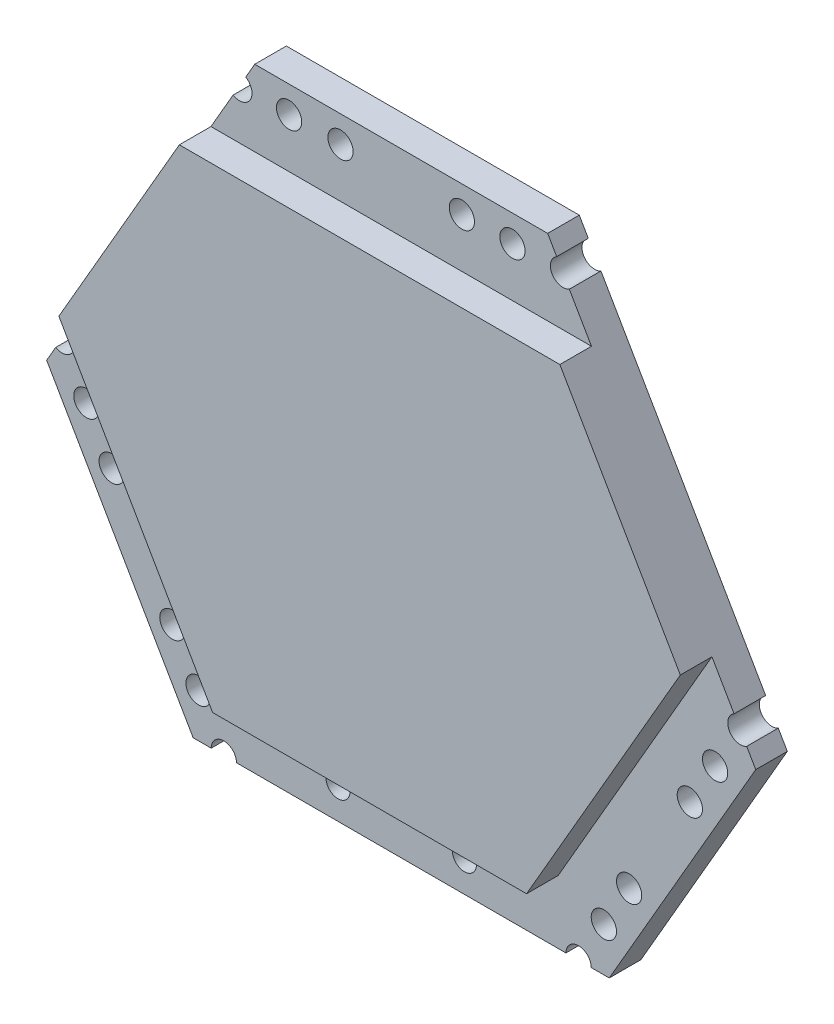
from build123d import *

# Parameters (mm, degrees)
EXTRUDE_4_DEPTH      = 10
SKETCH_4_W           = 60.2
SKETCH_4_H           = 12
CUT_EXTRUDE_2_DEPTH  = 5
CUT_EXTRUDE_9_DEPTH  = 125.764203881
CUT_EXTRUDE_12_DEPTH = 127.561979888
CUT_EXTRUDE_13_DEPTH = 124.620047186
CUT_EXTRUDE_15_DEPTH = 2
SKETCH_20_R          = 1.9
CUT_EXTRUDE_18_DEPTH = 10
CUT_EXTRUDE_19_DEPTH = 5


with BuildPart() as part:
    # 草圖1 → 填料-伸長4 (new body)
    with BuildSketch(Plane.XY):
        Polygon((49.802669845, 25.924393386), (-10.397330155, 25.924393386), (-29.457330155, -7.088495007), (0.642669845, -59.223224314), (38.762669845, -59.223224314), (68.862669845, -7.088495007), align=None)
        with BuildLine():
            Line((-0.037670798, 33.71862202), (-3.897330155, 33.71862202))
            ThreePointArc((-3.897330155, 33.71862202), (-4.897330155, 31.986571212), (-6.897330155, 31.986571212))
            Line((-6.897330155, 31.986571212), (-10.397330155, 25.924393386))
            Line((-10.397330155, 25.924393386), (49.802669845, 25.924393386))
            Line((49.802669845, 25.924393386), (46.302669845, 31.986571212))
            ThreePointArc((46.302669845, 31.986571212), (44.302669845, 31.986571212), (43.302669845, 33.71862202))
            Line((43.302669845, 33.71862202), (39.302669845, 33.71862202))
            ThreePointArc((39.302669845, 33.71862202), (37.302669845, 31.71862202), (35.302669845, 33.71862202))
            Line((35.302669845, 33.71862202), (31.302669845, 33.71862202))
            ThreePointArc((31.302669845, 33.71862202), (29.302669845, 31.71862202), (27.302669845, 33.71862202))
            Line((27.302669845, 33.71862202), (12.102669845, 33.71862202))
            ThreePointArc((12.102669845, 33.71862202), (10.102669845, 31.71862202), (8.102669845, 33.71862202))
            Line((8.102669845, 33.71862202), (3.962329202, 33.71862202))
            ThreePointArc((3.962329202, 33.71862202), (1.962329202, 31.71862202), (-0.037670798, 33.71862202))
        make_face()
        with BuildLine():
            ThreePointArc((-6.897330155, 31.986571212), (-6.897330155, 35.450672827), (-3.897330155, 33.71862202))
            Line((-3.897330155, 33.71862202), (-0.037670798, 33.71862202))
            ThreePointArc((-0.037670798, 33.71862202), (1.962329202, 35.71862202), (3.962329202, 33.71862202))
            Line((3.962329202, 33.71862202), (8.102669845, 33.71862202))
            ThreePointArc((8.102669845, 33.71862202), (10.102669845, 35.71862202), (12.102669845, 33.71862202))
            Line((12.102669845, 33.71862202), (27.302669845, 33.71862202))
            ThreePointArc((27.302669845, 33.71862202), (29.302669845, 35.71862202), (31.302669845, 33.71862202))
            Line((31.302669845, 33.71862202), (35.302669845, 33.71862202))
            ThreePointArc((35.302669845, 33.71862202), (37.302669845, 35.71862202), (39.302669845, 33.71862202))
            Line((39.302669845, 33.71862202), (43.302669845, 33.71862202))
            ThreePointArc((43.302669845, 33.71862202), (45.302669845, 35.71862202), (47.302669845, 33.71862202))
            ThreePointArc((47.302669845, 33.71862202), (47.034720652, 32.71862202), (46.302669845, 31.986571212))
            Line((46.302669845, 31.986571212), (49.802669845, 25.924393386))
            Line((49.802669845, 25.924393386), (49.802669845, 37.924393386))
            Line((49.802669845, 37.924393386), (-10.397330155, 37.924393386))
            Line((-10.397330155, 37.924393386), (-10.397330155, 25.924393386))
            Line((-10.397330155, 25.924393386), (-6.897330155, 31.986571212))
        make_face()
        with BuildLine():
            Line((-32.957330155, -13.150672833), (-29.457330155, -7.088495007))
            Line((-29.457330155, -7.088495007), (-39.849635001, -13.088495007))
            Line((-39.849635001, -13.088495007), (-9.749635001, -65.223224314))
            Line((-9.749635001, -65.223224314), (0.642669845, -59.223224314))
            Line((0.642669845, -59.223224314), (-6.357330155, -59.223224314))
            ThreePointArc((-6.357330155, -59.223224314), (-9.357330155, -60.955275122), (-9.357330155, -57.491173507))
            Line((-9.357330155, -57.491173507), (-11.357330155, -54.027071892))
            ThreePointArc((-11.357330155, -54.027071892), (-14.089380963, -53.295021084), (-13.357330155, -50.562970277))
            Line((-13.357330155, -50.562970277), (-15.394263476, -47.034898273))
            ThreePointArc((-15.394263476, -47.034898273), (-18.229721605, -46.366817854), (-17.390567155, -43.577198874))
            Line((-17.390567155, -43.577198874), (-24.994263476, -30.40721052))
            ThreePointArc((-24.994263476, -30.40721052), (-27.829721605, -29.739130101), (-26.990567155, -26.949511121))
            Line((-26.990567155, -26.949511121), (-28.994263476, -23.47900729))
            ThreePointArc((-28.994263476, -23.47900729), (-31.829721605, -22.810926871), (-30.990567155, -20.021307891))
            Line((-30.990567155, -20.021307891), (-32.957330155, -16.614774448))
            ThreePointArc((-32.957330155, -16.614774448), (-35.957330155, -14.882723641), (-32.957330155, -13.150672833))
        make_face()
        with BuildLine():
            Line((0.642669845, -59.223224314), (-29.457330155, -7.088495007))
            Line((-29.457330155, -7.088495007), (-32.957330155, -13.150672833))
            ThreePointArc((-32.957330155, -13.150672833), (-32.225279348, -13.882723641), (-31.957330155, -14.882723641))
            ThreePointArc((-31.957330155, -14.882723641), (-32.225279348, -15.882723641), (-32.957330155, -16.614774448))
            Line((-32.957330155, -16.614774448), (-30.990567155, -20.021307891))
            ThreePointArc((-30.990567155, -20.021307891), (-29.045480871, -20.110075214), (-28.097670798, -21.810926871))
            ThreePointArc((-28.097670798, -21.810926871), (-28.336021763, -22.75781265), (-28.994263476, -23.47900729))
            Line((-28.994263476, -23.47900729), (-26.990567155, -26.949511121))
            ThreePointArc((-26.990567155, -26.949511121), (-25.045480871, -27.038278445), (-24.097670798, -28.739130101))
            ThreePointArc((-24.097670798, -28.739130101), (-24.336021763, -29.68601588), (-24.994263476, -30.40721052))
            Line((-24.994263476, -30.40721052), (-17.390567155, -43.577198874))
            ThreePointArc((-17.390567155, -43.577198874), (-15.445480871, -43.665966197), (-14.497670798, -45.366817854))
            ThreePointArc((-14.497670798, -45.366817854), (-14.736021763, -46.313703633), (-15.394263476, -47.034898273))
            Line((-15.394263476, -47.034898273), (-13.357330155, -50.562970277))
            ThreePointArc((-13.357330155, -50.562970277), (-11.357330155, -50.562970277), (-10.357330155, -52.295021084))
            ThreePointArc((-10.357330155, -52.295021084), (-10.625279348, -53.295021084), (-11.357330155, -54.027071892))
            Line((-11.357330155, -54.027071892), (-9.357330155, -57.491173507))
            ThreePointArc((-9.357330155, -57.491173507), (-7.357330155, -57.491173507), (-6.357330155, -59.223224314))
            Line((-6.357330155, -59.223224314), (0.642669845, -59.223224314))
        make_face()
        with BuildLine():
            Line((79.25497469, -13.088495007), (68.862669845, -7.088495007))
            Line((68.862669845, -7.088495007), (72.362669845, -13.150672833))
            ThreePointArc((72.362669845, -13.150672833), (74.362669845, -13.150672833), (75.362669845, -14.882723641))
            ThreePointArc((75.362669845, -14.882723641), (74.362669845, -16.614774448), (72.362669845, -16.614774448))
            Line((72.362669845, -16.614774448), (70.362669845, -20.078876063))
            ThreePointArc((70.362669845, -20.078876063), (71.094720652, -20.810926871), (71.362669845, -21.810926871))
            ThreePointArc((71.362669845, -21.810926871), (70.362669845, -23.542977679), (68.362669845, -23.542977679))
            Line((68.362669845, -23.542977679), (66.362669845, -27.007079294))
            ThreePointArc((66.362669845, -27.007079294), (67.094720652, -27.739130101), (67.362669845, -28.739130101))
            ThreePointArc((67.362669845, -28.739130101), (66.362669845, -30.471180909), (64.362669845, -30.471180909))
            Line((64.362669845, -30.471180909), (56.762669845, -43.634767046))
            ThreePointArc((56.762669845, -43.634767046), (57.494720652, -44.366817854), (57.762669845, -45.366817854))
            ThreePointArc((57.762669845, -45.366817854), (56.762669845, -47.098868661), (54.762669845, -47.098868661))
            Line((54.762669845, -47.098868661), (52.762669845, -50.562970277))
            ThreePointArc((52.762669845, -50.562970277), (53.494720652, -51.295021084), (53.762669845, -52.295021084))
            ThreePointArc((53.762669845, -52.295021084), (52.762669845, -54.027071892), (50.762669845, -54.027071892))
            Line((50.762669845, -54.027071892), (48.762669845, -57.491173507))
            ThreePointArc((48.762669845, -57.491173507), (49.494720652, -58.223224314), (49.762669845, -59.223224314))
            ThreePointArc((49.762669845, -59.223224314), (47.762669845, -61.223224314), (45.762669845, -59.223224314))
            Line((45.762669845, -59.223224314), (38.762669845, -59.223224314))
            Line((38.762669845, -59.223224314), (49.15497469, -65.223224314))
            Line((49.15497469, -65.223224314), (79.25497469, -13.088495007))
        make_face()
        with BuildLine():
            Line((72.362669845, -13.150672833), (68.862669845, -7.088495007))
            Line((68.862669845, -7.088495007), (38.762669845, -59.223224314))
            Line((38.762669845, -59.223224314), (45.762669845, -59.223224314))
            ThreePointArc((45.762669845, -59.223224314), (46.762669845, -57.491173507), (48.762669845, -57.491173507))
            Line((48.762669845, -57.491173507), (50.762669845, -54.027071892))
            ThreePointArc((50.762669845, -54.027071892), (50.030619037, -51.295021084), (52.762669845, -50.562970277))
            Line((52.762669845, -50.562970277), (54.762669845, -47.098868661))
            ThreePointArc((54.762669845, -47.098868661), (54.030619037, -44.366817854), (56.762669845, -43.634767046))
            Line((56.762669845, -43.634767046), (64.362669845, -30.471180909))
            ThreePointArc((64.362669845, -30.471180909), (63.630619037, -27.739130101), (66.362669845, -27.007079294))
            Line((66.362669845, -27.007079294), (68.362669845, -23.542977679))
            ThreePointArc((68.362669845, -23.542977679), (67.630619037, -20.810926871), (70.362669845, -20.078876063))
            Line((70.362669845, -20.078876063), (72.362669845, -16.614774448))
            ThreePointArc((72.362669845, -16.614774448), (71.362669845, -14.882723641), (72.362669845, -13.150672833))
        make_face()
    extrude(amount=EXTRUDE_4_DEPTH)

    # 草圖4 → 除料-伸長2 (cut)
    with BuildSketch(Plane.XY.offset(10)):
        Polygon((38.762669845, -59.223224314), (49.15497469, -65.223224314), (79.264488572, -13.07201648), (68.872183727, -7.07201648), align=None)
        with Locations((19.702669845, 31.924393386)):
            Rectangle(SKETCH_4_W, SKETCH_4_H)
        Polygon((-29.457330155, -7.088495007), (-39.849635001, -13.088495007), (-9.472158735, -65.703827304), (0.92014611, -59.703827304), align=None)
    extrude(amount=-CUT_EXTRUDE_2_DEPTH, mode=Mode.SUBTRACT)

    # 草圖7 → 除料-伸長9 (cut, through all)
    with BuildSketch(Plane(origin=(-19.023589241, 10.983274369, 0), x_dir=(0, 0, 1), z_dir=(-0.8660254037844397, 0.499999999999998, 0))):
        Polygon((5, -20.867481828), (0, -20.867481828), (0, -53.816238545), (10, -53.816238545), (10, -20.867481828), align=None)
        Polygon((0, 46.26799966), (0, 17.252518172), (5, 17.252518172), (10, 17.252518172), (10, 46.26799966), align=None)
    extrude(amount=CUT_EXTRUDE_9_DEPTH, mode=Mode.SUBTRACT)

    # 草圖12 → 除料-伸長12 (cut, through all)
    with BuildSketch(Plane(origin=(48.577594008, 28.046286977, 0), x_dir=(0, 0, -1), z_dir=(0.8660254037844363, 0.5000000000000042, 0))):
        Polygon((0, -70.38008838), (0, -40.570151673), (-5, -40.570151673), (-10, -40.570151673), (-10, -70.38008838), align=None)
        Polygon((-5, -2.450151673), (0, -2.450151673), (0, 27.877960609), (-10, 27.877960609), (-10, -2.450151673), align=None)
    extrude(amount=CUT_EXTRUDE_12_DEPTH, mode=Mode.SUBTRACT)

    # 草圖13 → 除料-伸長13 (cut, through all)
    with BuildSketch(Plane.XZ.offset(59.223224314)):
        Polygon((66.260162627, 10), (38.762669845, 10), (38.762669845, 5), (38.762669845, 0), (66.260162627, 0), align=None)
        Polygon((0.642669845, 5), (0.642669845, 10), (-25.338575987, 10), (-25.338575987, 0), (0.642669845, 0), align=None)
    extrude(amount=CUT_EXTRUDE_13_DEPTH, mode=Mode.SUBTRACT)

    # 草圖17 → 除料-伸長15 (cut)
    # profile 1 of 6: a face of its own
    with BuildSketch(Plane(origin=(0, 0, 0), x_dir=(-1, 0, 0), z_dir=(0, 0, -1))):
        with BuildLine():
            Line((-28.264869636, -8.814389023), (-26.341517093, -8.814389023))
            add(Edge.make_bspline(
                [(-26.341517093, -8.814389023), (-26.267762258, -8.815115902), (-26.125122028, -8.81652167), (-25.917994809, -8.821198537), (-25.724588531, -8.831498349), (-25.545173867, -8.848220675), (-25.379122319, -8.865738903), (-25.227129952, -8.890048986), (-25.088726858, -8.917588419), (-24.962442322, -8.949442158), (-24.846181362, -8.988723142), (-24.736434733, -9.034877236), (-24.633052769, -9.09146439), (-24.535793645, -9.157147599), (-24.44309089, -9.23066092), (-24.356661164, -9.313299245), (-24.276156697, -9.404856412), (-24.200765488, -9.505399171), (-24.131548469, -9.618323397), (-24.073246605, -9.747418162), (-24.024668758, -9.892341629), (-23.982810629, -10.052463218), (-23.953582049, -10.228812497), (-23.931027342, -10.420501005), (-23.915691302, -10.628199446), (-23.914797229, -10.772367713), (-23.914334154, -10.847038106)],
                knots=[0, 0, 0, 0, 1.41969272, 2.745654521, 3.987543411, 5.14658096, 6.21373459, 7.200711201, 8.108042895, 8.929411192, 9.70554979, 10.467999137, 11.218070552, 11.969943563, 12.724535131, 13.49271798, 14.268243868, 15.068689038, 15.909069341, 16.81215954, 17.78844528, 18.848344307, 19.994182421, 21.225693104, 22.563077773, 24, 24, 24, 24], degree=3))
            add(Edge.make_bspline(
                [(-23.914334154, -10.847038106), (-23.914545592, -10.897268376), (-23.914952171, -10.993857585), (-23.926359188, -11.132606), (-23.942081658, -11.259389383), (-23.962464159, -11.375166198), (-23.99183029, -11.478452761), (-24.026413023, -11.570667737), (-24.0673573, -11.65118762), (-24.116534517, -11.721401469), (-24.175850425, -11.782838537), (-24.246487256, -11.839097947), (-24.328513003, -11.89209201), (-24.423970742, -11.939643172), (-24.529946257, -11.987246124), (-24.650266399, -12.026701299), (-24.781418342, -12.06661713), (-24.873852581, -12.087658071), (-24.921994946, -12.098616788)],
                knots=[0, 0, 0, 0, 1.327920484, 2.553495959, 3.678584238, 4.706394844, 5.65862556, 6.514014339, 7.30753027, 8.04101456, 8.772331145, 9.55771541, 10.424646689, 11.349518022, 12.375513716, 13.493956262, 14.694781581, 16, 16, 16, 16], degree=3))
            add(Edge.make_bspline(
                [(-24.921994946, -12.098616788), (-24.87070196, -12.111229348), (-24.771641552, -12.135587558), (-24.630933388, -12.182628868), (-24.503128838, -12.235715251), (-24.387482117, -12.293945116), (-24.285245803, -12.359726309), (-24.195785759, -12.431551488), (-24.118375022, -12.50916541), (-24.054998232, -12.595151954), (-24.000825085, -12.689169527), (-23.95400598, -12.793541234), (-23.916196822, -12.90998304), (-23.883985732, -13.03775057), (-23.859030899, -13.17669102), (-23.842129631, -13.327642225), (-23.83143877, -13.48955044), (-23.829848941, -13.6016488), (-23.829029537, -13.659424708)],
                knots=[0, 0, 0, 0, 1.193541528, 2.305046348, 3.349469872, 4.319601517, 5.227715379, 6.091898615, 6.908561027, 7.697906746, 8.498857849, 9.357421084, 10.27838222, 11.262396817, 12.333987418, 13.466302598, 14.694123014, 16, 16, 16, 16], degree=3))
            Line((-23.829029537, -13.659424708), (-23.829029537, -14.340528761))
            add(Edge.make_bspline(
                [(-23.829029537, -14.340528761), (-23.829505112, -14.400518082), (-23.830425013, -14.51655473), (-23.838478833, -14.684611184), (-23.851525572, -14.840705903), (-23.86996245, -14.984848735), (-23.893688343, -15.117061175), (-23.922765716, -15.237339911), (-23.957102227, -15.345782049), (-24.009390324, -15.471867389), (-24.089879669, -15.610982556), (-24.215684315, -15.750115201), (-24.366155705, -15.861445774), (-24.514101564, -15.92923552), (-24.65254922, -15.968458762), (-24.782211478, -15.994784395), (-24.935730119, -16.016942256), (-25.114202653, -16.033208005), (-25.315917824, -16.047983273), (-25.542569572, -16.058779324), (-25.793240946, -16.063115231), (-25.968753201, -16.064539021), (-26.060278433, -16.065281492)],
                knots=[0, 0, 0, 0, 1.057231904, 2.044991421, 2.964498811, 3.817267374, 4.605195048, 5.330688826, 5.996832831, 6.607610909, 7.734358025, 8.809960447, 9.890596186, 11.011751471, 11.656044114, 12.423911222, 13.341950389, 14.388368498, 15.581715371, 16.906549738, 18.386843414, 20, 20, 20, 20], degree=3))
            Line((-26.060278433, -16.065281492), (-28.264869636, -16.065281492))
            Line((-28.264869636, -16.065281492), (-28.264869636, -8.814389023))
        make_face()
        with BuildLine():
            Line((-26.388168055, -10.008653665), (-26.388168055, -11.629441393))
            add(Edge.make_bspline(
                [(-26.388168055, -11.629441393), (-26.348627402, -11.628467699), (-26.279324388, -11.626761104), (-26.210006709, -11.625838817), (-26.180238051, -11.625442739)],
                knots=[0, 0, 0, 0, 1.141094767, 2, 2, 2, 2], degree=3))
            add(Edge.make_bspline(
                [(-26.180238051, -11.625442739), (-26.13339575, -11.624601426), (-26.048527942, -11.623077154), (-25.934771281, -11.596358512), (-25.846030816, -11.555163468), (-25.792635238, -11.499907409), (-25.766930352, -11.441478395), (-25.750106372, -11.382794381), (-25.737820926, -11.3080112), (-25.725640796, -11.217839383), (-25.716796995, -11.11106724), (-25.710343018, -10.988836379), (-25.706373156, -10.850617975), (-25.705953409, -10.753294588), (-25.705731117, -10.70175368)],
                knots=[0, 0, 0, 0, 1.37184632, 2.485479705, 3.407178563, 4.210095408, 4.671083265, 5.269542147, 5.998719677, 6.893441603, 7.940942625, 9.142754617, 10.486848569, 12, 12, 12, 12], degree=3))
            add(Edge.make_bspline(
                [(-25.705731117, -10.70175368), (-25.706198799, -10.64883793), (-25.707061326, -10.551247575), (-25.720353628, -10.418015675), (-25.73960551, -10.309521989), (-25.770856552, -10.22507981), (-25.809226319, -10.16018185), (-25.852546404, -10.10960011), (-25.900954065, -10.070757882), (-25.959328104, -10.045363778), (-26.032540593, -10.030012715), (-26.127520941, -10.018871401), (-26.248997502, -10.011321367), (-26.338839535, -10.009599223), (-26.388168055, -10.008653665)],
                knots=[0, 0, 0, 0, 1.612962093, 2.974720053, 4.080187332, 4.963539136, 5.704836737, 6.3676796, 6.985654596, 7.580003915, 8.289925548, 9.259673838, 10.495400982, 12, 12, 12, 12], degree=3))
        make_face(mode=Mode.SUBTRACT)
        with BuildLine():
            Line((-26.388168055, -12.738401418), (-26.388168055, -14.87101685))
            add(Edge.make_bspline(
                [(-26.388168055, -14.87101685), (-26.35305961, -14.869447307), (-26.28632605, -14.866463945), (-26.191048904, -14.858980228), (-26.106164604, -14.846780723), (-26.030668981, -14.832791901), (-25.965259964, -14.813971145), (-25.909244516, -14.793165974), (-25.862715198, -14.769673145), (-25.825758674, -14.740281269), (-25.796642501, -14.703032502), (-25.771038564, -14.65751132), (-25.751977124, -14.599851142), (-25.734810026, -14.532653675), (-25.721639155, -14.454624646), (-25.713051255, -14.365993418), (-25.705627469, -14.266895385), (-25.70569558, -14.197038003), (-25.705731117, -14.160589334)],
                knots=[0, 0, 0, 0, 1.419095288, 2.697393149, 3.856866357, 4.880718774, 5.794967692, 6.601281627, 7.291456808, 7.891047755, 8.490638702, 9.189387817, 9.989490768, 10.933700266, 11.989587216, 13.180284702, 14.528790147, 16, 16, 16, 16], degree=3))
            Line((-25.705731117, -14.160589334), (-25.705731117, -13.448828934))
            add(Edge.make_bspline(
                [(-25.705731117, -13.448828934), (-25.70589286, -13.410174498), (-25.706199794, -13.336821112), (-25.710970428, -13.232667429), (-25.721522564, -13.14044912), (-25.729773612, -13.059711845), (-25.747012676, -12.991914807), (-25.764397444, -12.935368222), (-25.787013738, -12.890838403), (-25.813350404, -12.855669945), (-25.849250442, -12.830476588), (-25.892970299, -12.807968397), (-25.948919789, -12.789906803), (-26.015373432, -12.774304516), (-26.092865593, -12.761232827), (-26.181382347, -12.75072845), (-26.280987773, -12.742870511), (-26.351278671, -12.739939593), (-26.388168055, -12.738401418)],
                knots=[0, 0, 0, 0, 1.538310229, 2.919206019, 4.145426389, 5.233175983, 6.142307499, 6.925059207, 7.5813867, 8.122596664, 8.653013429, 9.309340922, 10.075339784, 10.9844713, 12.025073956, 13.200531974, 14.530810454, 16, 16, 16, 16], degree=3))
        make_face(mode=Mode.SUBTRACT)
    # profile 2 of 6: a face of its own
    with BuildSketch(Plane(origin=(0, 0, 0), x_dir=(-1, 0, 0), z_dir=(0, 0, -1))):
        with BuildLine():
            Line((-19.051970968, -10.093958282), (-19.051970968, -16.065281492))
            Line((-19.051970968, -16.065281492), (-20.872691394, -16.065281492))
            Line((-20.872691394, -16.065281492), (-20.843367932, -15.554786673))
            add(Edge.make_bspline(
                [(-20.843367932, -15.554786673), (-20.874561057, -15.602372526), (-20.935288618, -15.695013863), (-21.045492849, -15.815791893), (-21.164252292, -15.919778896), (-21.294628914, -16.004124678), (-21.4348255, -16.070446461), (-21.585599233, -16.116909205), (-21.746421104, -16.145530556), (-21.857127576, -16.148876875), (-21.913674302, -16.150586109)],
                knots=[0, 0, 0, 0, 1.061666706, 2.066879479, 3.043894156, 4.004116477, 4.958543322, 5.932696836, 6.944061519, 8, 8, 8, 8], degree=3))
            add(Edge.make_bspline(
                [(-21.913674302, -16.150586109), (-21.977320315, -16.148883933), (-22.099437057, -16.14561799), (-22.274236592, -16.118411095), (-22.433154809, -16.075805994), (-22.573790928, -16.012107986), (-22.698074444, -15.935393045), (-22.801887793, -15.842448198), (-22.89428073, -15.743015815), (-22.963237712, -15.628102373), (-23.019241662, -15.507903276), (-23.062359129, -15.384278164), (-23.096874725, -15.258950394), (-23.115047393, -15.15008024), (-23.123138033, -15.053220645), (-23.13003851, -14.964841798), (-23.135179206, -14.860392925), (-23.138686045, -14.740397451), (-23.143129752, -14.604463561), (-23.145526106, -14.452499122), (-23.146901146, -14.284550315), (-23.146698517, -14.167254082), (-23.146592598, -14.105941064)],
                knots=[0, 0, 0, 0, 1.372356562, 2.633121929, 3.807600132, 4.910298633, 5.952776581, 6.944670893, 7.908661259, 8.868831557, 9.820833315, 10.766735229, 11.689826756, 12.622720248, 13.142547126, 13.786556214, 14.535201573, 15.398368654, 16.376504451, 17.469410664, 18.677211821, 20, 20, 20, 20], degree=3))
            Line((-23.146592598, -14.105941064), (-23.146592598, -10.093958282))
            Line((-23.146592598, -10.093958282), (-21.355195635, -10.093958282))
            Line((-21.355195635, -10.093958282), (-21.355195635, -14.165920873))
            add(Edge.make_bspline(
                [(-21.355195635, -14.165920873), (-21.355483268, -14.22146045), (-21.356026359, -14.326327178), (-21.352441081, -14.474704868), (-21.350430116, -14.604910953), (-21.346437004, -14.717334448), (-21.34134959, -14.8120173), (-21.334912995, -14.88937449), (-21.327560195, -14.949151643), (-21.316329142, -15.003533174), (-21.292973204, -15.055582882), (-21.242936007, -15.097903731), (-21.177569732, -15.123847815), (-21.128436747, -15.125850818), (-21.101947553, -15.126930702)],
                knots=[0, 0, 0, 0, 1.812042913, 3.421398194, 4.842335651, 6.06080483, 7.091677302, 7.935583642, 8.593692084, 9.054393081, 9.748100288, 10.405409957, 11.140304508, 12, 12, 12, 12], degree=3))
            add(Edge.make_bspline(
                [(-21.101947553, -15.126930702), (-21.073729485, -15.125863408), (-21.022077881, -15.123909786), (-20.952503397, -15.098511419), (-20.901904685, -15.053403595), (-20.87870582, -14.99908477), (-20.870544772, -14.94267611), (-20.861531386, -14.880612152), (-20.857963766, -14.799470556), (-20.85188875, -14.700027787), (-20.848211071, -14.581798625), (-20.846092348, -14.444939768), (-20.842550844, -14.289004779), (-20.843085521, -14.178807716), (-20.843367932, -14.120602795)],
                knots=[0, 0, 0, 0, 0.876067957, 1.603593713, 2.260088472, 2.929160625, 3.393475713, 4.035657034, 4.88190587, 5.921621531, 7.140530935, 8.566649448, 10.186540624, 12, 12, 12, 12], degree=3))
            Line((-20.843367932, -14.120602795), (-20.843367932, -10.093958282))
            Line((-20.843367932, -10.093958282), (-19.051970968, -10.093958282))
        make_face()
    # profile 3 of 6: a face of its own
    with BuildSketch(Plane(origin=(0, 0, 0), x_dir=(-1, 0, 0), z_dir=(0, 0, -1))):
        with BuildLine():
            Line((-16.578137067, -9.326216726), (-16.578137067, -10.264567517))
            Line((-16.578137067, -10.264567517), (-15.981004746, -10.264567517))
            Line((-15.981004746, -10.264567517), (-15.981004746, -11.202918307))
            Line((-15.981004746, -11.202918307), (-16.578137067, -11.202918307))
            Line((-16.578137067, -11.202918307), (-16.578137067, -14.401841455))
            add(Edge.make_bspline(
                [(-16.578137067, -14.401841455), (-16.57772504, -14.448490612), (-16.576951928, -14.53602112), (-16.575384829, -14.659188405), (-16.568259875, -14.765828326), (-16.560138016, -14.856438872), (-16.552574558, -14.931194326), (-16.538680883, -14.988997266), (-16.525528834, -15.031426237), (-16.506818618, -15.062029103), (-16.476105822, -15.079180256), (-16.435392999, -15.091628799), (-16.380217783, -15.101498207), (-16.311280427, -15.110504809), (-16.227735193, -15.118722324), (-16.129897624, -15.123604649), (-16.017448194, -15.125910124), (-15.937909099, -15.126576877), (-15.895700129, -15.126930702)],
                knots=[0, 0, 0, 0, 1.739732428, 3.26436042, 4.592396978, 5.723406921, 6.6584426, 7.389883741, 7.934871935, 8.316298907, 8.688621296, 9.212551535, 9.90465525, 10.773969042, 11.805991926, 13.033823307, 14.425940557, 16, 16, 16, 16], degree=3))
            Line((-15.895700129, -15.126930702), (-15.895700129, -16.065281492))
            Line((-15.895700129, -16.065281492), (-16.655444377, -16.065281492))
            add(Edge.make_bspline(
                [(-16.655444377, -16.065281492), (-16.706982165, -16.064789789), (-16.806503684, -16.063840292), (-16.950035343, -16.063235804), (-17.082046928, -16.059497213), (-17.20238044, -16.052064623), (-17.311290148, -16.045894772), (-17.409174104, -16.038397564), (-17.495342245, -16.02750067), (-17.594455667, -16.012460518), (-17.707106433, -15.98284398), (-17.833793738, -15.932713397), (-17.950667662, -15.862745442), (-18.059436122, -15.780495244), (-18.15261321, -15.68422412), (-18.229378554, -15.580124337), (-18.285655158, -15.468898738), (-18.317651724, -15.367524841), (-18.332167556, -15.274225456), (-18.343148186, -15.184039713), (-18.35028694, -15.073230571), (-18.356461587, -14.942120176), (-18.363836416, -14.791108395), (-18.367513585, -14.620008195), (-18.368103396, -14.428498571), (-18.36904167, -14.293877505), (-18.36953403, -14.223234913)],
                knots=[0, 0, 0, 0, 1.195583195, 2.308718731, 3.329517598, 4.258521121, 5.105212991, 5.860114927, 6.535083728, 7.11964657, 8.184549345, 9.22951552, 10.268875888, 11.334626177, 12.384156653, 13.365429045, 14.324142953, 15.262984696, 15.817041888, 16.512473617, 17.370134424, 18.391765408, 19.557524602, 20.877102082, 22.361254963, 24, 24, 24, 24], degree=3))
            Line((-18.36953403, -14.223234913), (-18.36953403, -11.202918307))
            Line((-18.36953403, -11.202918307), (-18.710752499, -11.202918307))
            Line((-18.710752499, -11.202918307), (-18.710752499, -10.264567517))
            Line((-18.710752499, -10.264567517), (-18.36953403, -10.264567517))
            Line((-18.36953403, -10.264567517), (-18.36953403, -9.326216726))
            Line((-18.36953403, -9.326216726), (-16.578137067, -9.326216726))
        make_face()
    # profile 4 of 6: a face of its own
    with BuildSketch(Plane(origin=(0, 0, 0), x_dir=(-1, 0, 0), z_dir=(0, 0, -1))):
        with BuildLine():
            Line((-13.763084697, -9.326216726), (-13.763084697, -10.264567517))
            Line((-13.763084697, -10.264567517), (-13.165952376, -10.264567517))
            Line((-13.165952376, -10.264567517), (-13.165952376, -11.202918307))
            Line((-13.165952376, -11.202918307), (-13.763084697, -11.202918307))
            Line((-13.763084697, -11.202918307), (-13.763084697, -14.401841455))
            add(Edge.make_bspline(
                [(-13.763084697, -14.401841455), (-13.762672669, -14.448490612), (-13.761899558, -14.53602112), (-13.760332458, -14.659188405), (-13.753207504, -14.765828326), (-13.745085645, -14.856438872), (-13.737522187, -14.931194326), (-13.723628513, -14.988997266), (-13.710476463, -15.031426237), (-13.691766247, -15.062029103), (-13.661053451, -15.079180256), (-13.620340628, -15.091628799), (-13.565165413, -15.101498207), (-13.496228056, -15.110504809), (-13.412682823, -15.118722324), (-13.314845254, -15.123604649), (-13.202395823, -15.125910124), (-13.122856728, -15.126576877), (-13.080647758, -15.126930702)],
                knots=[0, 0, 0, 0, 1.739732428, 3.26436042, 4.592396978, 5.723406921, 6.6584426, 7.389883741, 7.934871935, 8.316298907, 8.688621296, 9.212551535, 9.90465525, 10.773969042, 11.805991926, 13.033823307, 14.425940557, 16, 16, 16, 16], degree=3))
            Line((-13.080647758, -15.126930702), (-13.080647758, -16.065281492))
            Line((-13.080647758, -16.065281492), (-13.840392006, -16.065281492))
            add(Edge.make_bspline(
                [(-13.840392006, -16.065281492), (-13.891929794, -16.064789789), (-13.991451314, -16.063840292), (-14.134982972, -16.063235804), (-14.266994557, -16.059497213), (-14.387328069, -16.052064623), (-14.496237778, -16.045894772), (-14.594121734, -16.038397564), (-14.680289874, -16.02750067), (-14.779403296, -16.012460518), (-14.892054063, -15.98284398), (-15.018741367, -15.932713397), (-15.135615292, -15.862745442), (-15.244383752, -15.780495244), (-15.33756084, -15.68422412), (-15.414326183, -15.580124337), (-15.470602788, -15.468898738), (-15.502599354, -15.367524841), (-15.517115185, -15.274225456), (-15.528095816, -15.184039713), (-15.535234569, -15.073230571), (-15.541409216, -14.942120176), (-15.548784045, -14.791108395), (-15.552461214, -14.620008195), (-15.553051026, -14.428498571), (-15.553989299, -14.293877505), (-15.55448166, -14.223234913)],
                knots=[0, 0, 0, 0, 1.195583195, 2.308718731, 3.329517598, 4.258521121, 5.105212991, 5.860114927, 6.535083728, 7.11964657, 8.184549345, 9.22951552, 10.268875888, 11.334626177, 12.384156653, 13.365429045, 14.324142953, 15.262984696, 15.817041888, 16.512473617, 17.370134424, 18.391765408, 19.557524602, 20.877102082, 22.361254963, 24, 24, 24, 24], degree=3))
            Line((-15.55448166, -14.223234913), (-15.55448166, -11.202918307))
            Line((-15.55448166, -11.202918307), (-15.895700129, -11.202918307))
            Line((-15.895700129, -11.202918307), (-15.895700129, -10.264567517))
            Line((-15.895700129, -10.264567517), (-15.55448166, -10.264567517))
            Line((-15.55448166, -10.264567517), (-15.55448166, -9.326216726))
            Line((-15.55448166, -9.326216726), (-13.763084697, -9.326216726))
        make_face()
    # profile 5 of 6: a face of its own
    with BuildSketch(Plane(origin=(0, 0, 0), x_dir=(-1, 0, 0), z_dir=(0, 0, -1))):
        with BuildLine():
            Line((-8.730112276, -12.197250252), (-8.730112276, -13.648761631))
            add(Edge.make_bspline(
                [(-8.730112276, -13.648761631), (-8.730293448, -13.713188861), (-8.730643333, -13.837613448), (-8.735408429, -14.017533459), (-8.739384751, -14.184265863), (-8.749874469, -14.337460127), (-8.759104903, -14.477656473), (-8.774656527, -14.604153847), (-8.789877113, -14.717679785), (-8.8145127, -14.851113074), (-8.857076418, -15.007230152), (-8.93079345, -15.186246787), (-9.030043318, -15.35718225), (-9.147364952, -15.522144975), (-9.28584171, -15.674166276), (-9.446854574, -15.803858122), (-9.624368386, -15.914953122), (-9.821272691, -16.00215827), (-10.034924377, -16.06840171), (-10.26347664, -16.1157131), (-10.506927345, -16.145971569), (-10.674253892, -16.149021458), (-10.760095591, -16.150586109)],
                knots=[0, 0, 0, 0, 1.030820639, 1.990764312, 2.879836517, 3.698877591, 4.447479564, 5.127340947, 5.737592725, 6.27997261, 7.297519797, 8.320663796, 9.368189507, 10.453252059, 11.55504584, 12.646447391, 13.751149947, 14.896660089, 16.081551939, 17.323827552, 18.627072679, 20, 20, 20, 20], degree=3))
            add(Edge.make_bspline(
                [(-10.760095591, -16.150586109), (-10.855239288, -16.149324595), (-11.03789803, -16.146902715), (-11.300698837, -16.120977312), (-11.541008677, -16.080458828), (-11.759500225, -16.024475844), (-11.954567983, -15.949025166), (-12.128311369, -15.859475932), (-12.278057512, -15.750284414), (-12.405385801, -15.624646881), (-12.510995702, -15.482372351), (-12.600611168, -15.327013188), (-12.673829186, -15.157875229), (-12.722151825, -15.006429513), (-12.751521481, -14.874151774), (-12.771848188, -14.76218727), (-12.786646389, -14.637874899), (-12.80205214, -14.50250067), (-12.812561877, -14.354874863), (-12.818124348, -14.19570913), (-12.824556131, -14.024682675), (-12.82467333, -13.906904224), (-12.824733906, -13.846028558)],
                knots=[0, 0, 0, 0, 1.566851768, 3.008072865, 4.344862402, 5.578649608, 6.716279408, 7.783554075, 8.789251884, 9.757031178, 10.718730646, 11.699157592, 12.705361265, 13.749293612, 14.312132592, 14.936642054, 15.622938965, 16.373791341, 17.180992382, 18.06001777, 18.997289313, 20, 20, 20, 20], degree=3))
            Line((-12.824733906, -13.846028558), (-12.824733906, -12.326540063))
            add(Edge.make_bspline(
                [(-12.824733906, -12.326540063), (-12.82420518, -12.259447333), (-12.823178842, -12.129210019), (-12.815747971, -11.939307725), (-12.800250974, -11.761196441), (-12.782892895, -11.593744521), (-12.756725074, -11.438363315), (-12.728476175, -11.293366858), (-12.69224957, -11.160420253), (-12.651174878, -11.037020834), (-12.600878292, -10.922845532), (-12.544280366, -10.814157731), (-12.476088261, -10.712790023), (-12.402806716, -10.614842148), (-12.31685791, -10.525333475), (-12.224355894, -10.440023924), (-12.121965922, -10.361098527), (-12.0118866, -10.287831689), (-11.892497471, -10.222056484), (-11.764638653, -10.165604853), (-11.629817111, -10.115179498), (-11.485811474, -10.077286035), (-11.334440493, -10.04691774), (-11.174756894, -10.023951942), (-11.007355895, -10.01060764), (-10.892963723, -10.009312766), (-10.834737131, -10.008653665)],
                knots=[0, 0, 0, 0, 1.367165939, 2.653879496, 3.871100312, 5.009836591, 6.082946868, 7.080781523, 8.018528806, 8.888869268, 9.728143456, 10.558384481, 11.381984661, 12.214936081, 13.047543032, 13.906222177, 14.777268644, 15.678695825, 16.598484629, 17.550802427, 18.52460938, 19.528259021, 20.581129208, 21.669407874, 22.813708716, 24, 24, 24, 24], degree=3))
            add(Edge.make_bspline(
                [(-10.834737131, -10.008653665), (-10.737746241, -10.01023407), (-10.550643568, -10.01328279), (-10.280944416, -10.04973566), (-10.031669128, -10.103185937), (-9.805676164, -10.184881727), (-9.601871261, -10.281121964), (-9.421616532, -10.39235512), (-9.264528557, -10.516058261), (-9.135430656, -10.656318185), (-9.028438456, -10.803151061), (-8.937293472, -10.951892375), (-8.866830864, -11.104126953), (-8.821826299, -11.235063439), (-8.795336603, -11.345498509), (-8.778695949, -11.437744134), (-8.761821998, -11.539301529), (-8.750696102, -11.651519226), (-8.741336181, -11.773729699), (-8.734829221, -11.906179835), (-8.730817559, -12.048386065), (-8.730352256, -12.146597726), (-8.730112276, -12.197250252)],
                knots=[0, 0, 0, 0, 1.658815711, 3.199979415, 4.649957207, 6.01364259, 7.3027161, 8.501301308, 9.631864061, 10.713282271, 11.752046223, 12.737947139, 13.693922422, 14.617315316, 15.102372854, 15.636288777, 16.22136206, 16.863764619, 17.565366476, 18.319134645, 19.133096068, 20, 20, 20, 20], degree=3))
        make_face()
        with BuildLine():
            add(Edge.make_bspline(
                [(-10.52150924, -11.733406395), (-10.522014964, -11.696531716), (-10.522971584, -11.6267802), (-10.523395758, -11.527207208), (-10.52770394, -11.438787477), (-10.532878482, -11.360549507), (-10.539416221, -11.293433296), (-10.546723368, -11.236244938), (-10.557614542, -11.190627467), (-10.570485297, -11.144079084), (-10.597468963, -11.098952683), (-10.643020663, -11.057202546), (-10.705369488, -11.03698871), (-10.749775909, -11.033935207), (-10.773424437, -11.032309072)],
                knots=[0, 0, 0, 0, 1.585193112, 2.998524278, 4.279327145, 5.389603052, 6.36823621, 7.178467141, 7.864111684, 8.383615122, 9.248283339, 10.08726259, 10.981376477, 12, 12, 12, 12], degree=3))
            add(Edge.make_bspline(
                [(-10.773424437, -11.032309072), (-10.797593624, -11.033761939), (-10.842172194, -11.036441663), (-10.904340525, -11.058330122), (-10.952104137, -11.098202243), (-10.979725038, -11.144182588), (-10.995114716, -11.190316776), (-11.004882367, -11.23643203), (-11.014833639, -11.293246491), (-11.020003233, -11.360653317), (-11.027785227, -11.438696436), (-11.031248065, -11.527225009), (-11.031934748, -11.626774909), (-11.03285202, -11.696529886), (-11.033336943, -11.733406395)],
                knots=[0, 0, 0, 0, 1.033270833, 1.905804199, 2.770216926, 3.641090693, 4.164334303, 4.847116915, 5.656874259, 6.631422529, 7.738535089, 9.013991789, 10.421423604, 12, 12, 12, 12], degree=3))
            Line((-11.033336943, -11.733406395), (-11.033336943, -14.443160879))
            add(Edge.make_bspline(
                [(-11.033336943, -14.443160879), (-11.033266638, -14.508052696), (-11.033139384, -14.625506788), (-11.022132453, -14.783425545), (-11.008272441, -14.904569938), (-10.987074667, -14.993417814), (-10.953161958, -15.056223827), (-10.905359146, -15.09810338), (-10.844938138, -15.123211032), (-10.800780316, -15.125643861), (-10.777423091, -15.126930702)],
                knots=[0, 0, 0, 0, 1.905444241, 3.448851208, 4.646660283, 5.485608871, 6.116872217, 6.708589425, 7.316910003, 8, 8, 8, 8], degree=3))
            add(Edge.make_bspline(
                [(-10.777423091, -15.126930702), (-10.753245966, -15.12548136), (-10.708652752, -15.122808138), (-10.647180832, -15.1010888), (-10.599887059, -15.062466212), (-10.566673494, -15.004504875), (-10.545322777, -14.923338332), (-10.531088895, -14.812829357), (-10.522267917, -14.668998488), (-10.521779603, -14.562246009), (-10.52150924, -14.503140688)],
                knots=[0, 0, 0, 0, 0.759541473, 1.400927311, 2.016662793, 2.637613118, 3.469132219, 4.641499325, 6.140509111, 8, 8, 8, 8], degree=3))
            Line((-10.52150924, -14.503140688), (-10.52150924, -11.733406395))
        make_face(mode=Mode.SUBTRACT)
    # profile 6 of 6: a face of its own
    with BuildSketch(Plane(origin=(0, 0, 0), x_dir=(-1, 0, 0), z_dir=(0, 0, -1))):
        with BuildLine():
            Line((-6.341582992, -10.093958282), (-6.341582992, -10.675095987))
            add(Edge.make_bspline(
                [(-6.341582992, -10.675095987), (-6.305549353, -10.622112553), (-6.234982809, -10.51835235), (-6.109914432, -10.383222132), (-5.977317213, -10.265623612), (-5.831861127, -10.17257949), (-5.677391219, -10.097789467), (-5.511708846, -10.045918279), (-5.335981466, -10.014828405), (-5.215423569, -10.01073819), (-5.153982774, -10.008653665)],
                knots=[0, 0, 0, 0, 1.077223304, 2.1095822, 3.090370703, 4.052939172, 5.006340392, 5.971404446, 6.966152131, 8, 8, 8, 8], degree=3))
            add(Edge.make_bspline(
                [(-5.153982774, -10.008653665), (-5.09387408, -10.010741123), (-4.975962086, -10.014835977), (-4.804163119, -10.045867014), (-4.642173373, -10.098121127), (-4.490626485, -10.172529888), (-4.347842835, -10.266153452), (-4.216621645, -10.38279599), (-4.094387186, -10.518910864), (-4.024716956, -10.622203781), (-3.989041594, -10.675095987)],
                knots=[0, 0, 0, 0, 1.025789608, 2.012236342, 2.969316882, 3.922572519, 4.886093681, 5.875074288, 6.911909806, 8, 8, 8, 8], degree=3))
            add(Edge.make_bspline(
                [(-3.989041594, -10.675095987), (-3.95003764, -10.622326271), (-3.874202542, -10.519726502), (-3.747021849, -10.382758252), (-3.611981346, -10.267225894), (-3.469171479, -10.172768768), (-3.318622323, -10.09807349), (-3.15916627, -10.046464618), (-2.991960505, -10.014818075), (-2.878000112, -10.010730424), (-2.82010176, -10.008653665)],
                knots=[0, 0, 0, 0, 1.121403297, 2.180336103, 3.188108587, 4.153139269, 5.101063311, 6.052421157, 7.010519338, 8, 8, 8, 8], degree=3))
            add(Edge.make_bspline(
                [(-2.82010176, -10.008653665), (-2.745226201, -10.010777786), (-2.600372465, -10.014887096), (-2.394134627, -10.058599427), (-2.206815822, -10.127709031), (-2.043582477, -10.227144532), (-1.90398897, -10.345263145), (-1.789099564, -10.477212231), (-1.704210123, -10.623584356), (-1.655135048, -10.756612158), (-1.629693722, -10.873243271), (-1.612799972, -10.973868825), (-1.59627359, -11.08661401), (-1.585030355, -11.21256351), (-1.575715371, -11.350772641), (-1.569221566, -11.501878045), (-1.565222053, -11.665407203), (-1.564762355, -11.778721952), (-1.564524424, -11.837371398)],
                knots=[0, 0, 0, 0, 1.396274718, 2.701223389, 3.916961255, 5.107873857, 6.249837686, 7.3206937, 8.358018463, 9.39218657, 9.953717558, 10.585231331, 11.297424592, 12.080859583, 12.945645179, 13.884064098, 14.904833943, 16, 16, 16, 16], degree=3))
            Line((-1.564524424, -11.837371398), (-1.564524424, -16.065281492))
            Line((-1.564524424, -16.065281492), (-3.355921387, -16.065281492))
            Line((-3.355921387, -16.065281492), (-3.355921387, -12.163928136))
            add(Edge.make_bspline(
                [(-3.355921387, -12.163928136), (-3.356409641, -12.103059798), (-3.357336258, -11.987542894), (-3.35797903, -11.823135795), (-3.361519981, -11.676896684), (-3.369119129, -11.549022979), (-3.374490551, -11.43954111), (-3.384143554, -11.348467709), (-3.394126716, -11.275374479), (-3.408850149, -11.204688631), (-3.435210822, -11.135070556), (-3.489633276, -11.073875938), (-3.563899008, -11.038165664), (-3.618535923, -11.034352861), (-3.647823124, -11.032309072)],
                knots=[0, 0, 0, 0, 1.713054107, 3.251061448, 4.626981132, 5.828964419, 6.856173046, 7.710918569, 8.405859511, 8.930717602, 9.743458848, 10.46932057, 11.179504966, 12, 12, 12, 12], degree=3))
            add(Edge.make_bspline(
                [(-3.647823124, -11.032309072), (-3.677631346, -11.033703639), (-3.733907884, -11.036336518), (-3.808892877, -11.074095069), (-3.867511051, -11.133178546), (-3.895705211, -11.203202353), (-3.912565051, -11.273399909), (-3.921862239, -11.346789997), (-3.933684977, -11.437650944), (-3.938315435, -11.547713316), (-3.946277097, -11.67555508), (-3.949223131, -11.821815862), (-3.952172863, -11.986641741), (-3.952749065, -12.102613039), (-3.953053708, -12.163928136)],
                knots=[0, 0, 0, 0, 0.826216397, 1.559858194, 2.289277558, 3.106944553, 3.631407287, 4.309815047, 5.173054605, 6.193999705, 7.388653756, 8.756183606, 10.284964305, 12, 12, 12, 12], degree=3))
            Line((-3.953053708, -12.163928136), (-3.953053708, -16.065281492))
            Line((-3.953053708, -16.065281492), (-5.744450671, -16.065281492))
            Line((-5.744450671, -16.065281492), (-5.744450671, -12.263894484))
            add(Edge.make_bspline(
                [(-5.744450671, -12.263894484), (-5.744978303, -12.194141655), (-5.745976436, -12.062188525), (-5.74612308, -11.87510666), (-5.751190081, -11.710303094), (-5.754103896, -11.567174632), (-5.760648007, -11.44626662), (-5.769247528, -11.347301134), (-5.775594685, -11.269980791), (-5.789048011, -11.199120409), (-5.812767651, -11.130611515), (-5.867525003, -11.071917125), (-5.941724256, -11.036592474), (-5.997279414, -11.033802664), (-6.027022216, -11.032309072)],
                knots=[0, 0, 0, 0, 1.818527428, 3.440152716, 4.876833041, 6.116673496, 7.172292882, 8.032228621, 8.707612752, 9.19146093, 9.91415351, 10.561648488, 11.229943611, 12, 12, 12, 12], degree=3))
            add(Edge.make_bspline(
                [(-6.027022216, -11.032309072), (-6.046714002, -11.033183953), (-6.085576183, -11.034910551), (-6.141499754, -11.053358599), (-6.193209931, -11.082905219), (-6.237120957, -11.124936217), (-6.277112017, -11.172102422), (-6.303933295, -11.228043647), (-6.325519568, -11.287176166), (-6.333865286, -11.357780205), (-6.336794127, -11.448113702), (-6.339149462, -11.570799326), (-6.342438481, -11.73072298), (-6.341886607, -11.850252293), (-6.341582992, -11.916011592)],
                knots=[0, 0, 0, 0, 0.672379664, 1.326956341, 1.99518974, 2.695410677, 3.398931448, 4.099978799, 4.807439054, 5.545658748, 6.520718531, 7.90594544, 9.747647403, 12, 12, 12, 12], degree=3))
            Line((-6.341582992, -11.916011592), (-6.341582992, -16.065281492))
            Line((-6.341582992, -16.065281492), (-8.132979955, -16.065281492))
            Line((-8.132979955, -16.065281492), (-8.132979955, -10.093958282))
            Line((-8.132979955, -10.093958282), (-6.341582992, -10.093958282))
        make_face()
    extrude(amount=-CUT_EXTRUDE_15_DEPTH, mode=Mode.SUBTRACT)

    # 草圖20 → 除料-伸長18 (cut)
    with BuildSketch(Plane.XY.offset(10)):
        with Locations((29.702669845, -54.223224314)):
            Circle(SKETCH_20_R)
        with Locations((9.702669845, -54.223224314)):
            Circle(SKETCH_20_R)
    extrude(amount=-CUT_EXTRUDE_18_DEPTH, mode=Mode.SUBTRACT)

    # 草圖19 → 除料-伸長19 (cut)
    with BuildSketch(Plane.XY.offset(10)):
        Polygon((38.762669845, -59.223224314), (44.536172537, -49.223224314), (-5.130832847, -49.223224314), (0.642669845, -59.223224314), align=None)
    extrude(amount=-CUT_EXTRUDE_19_DEPTH, mode=Mode.SUBTRACT)


solid = part.part
